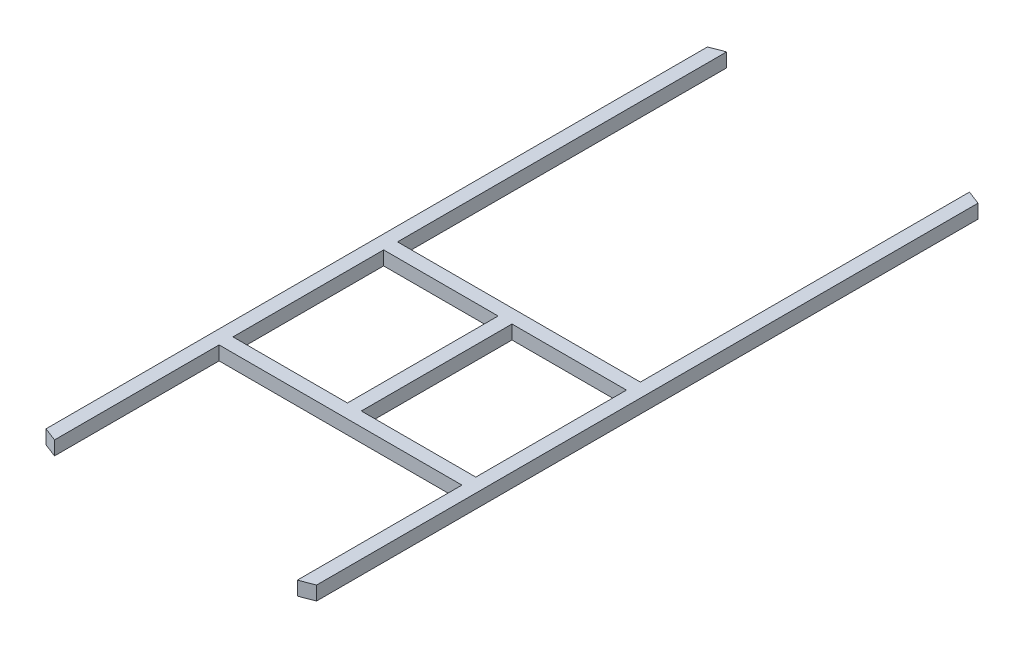
from build123d import *

# Parameters (mm, degrees)
SKETCH_1_W      = 33
SKETCH_1_H      = 43.435
EXTRUDE_1_DEPTH = 4


with BuildPart() as part:
    # 草图1 → 凸台-拉伸1 (new body)
    with BuildSketch(Plane(origin=(0, 0, 0), x_dir=(1, 0, 0), z_dir=(0, 1, 0))):
        Polygon((0, 0), (0, 95.33), (4, 96.87), (4, 2), (74, 2), (74, 96.87), (78, 95.33), (78, -95.33), (74, -96.87), (74, -49.435), (4, -49.435), (4, -96.87), (0, -95.33), align=None)
        with Locations((20.5, -23.7175)):
            Rectangle(SKETCH_1_W, SKETCH_1_H, mode=Mode.SUBTRACT)
        with Locations((57.5, -23.7175)):
            Rectangle(SKETCH_1_W, SKETCH_1_H, mode=Mode.SUBTRACT)
    extrude(amount=EXTRUDE_1_DEPTH)


solid = part.part
